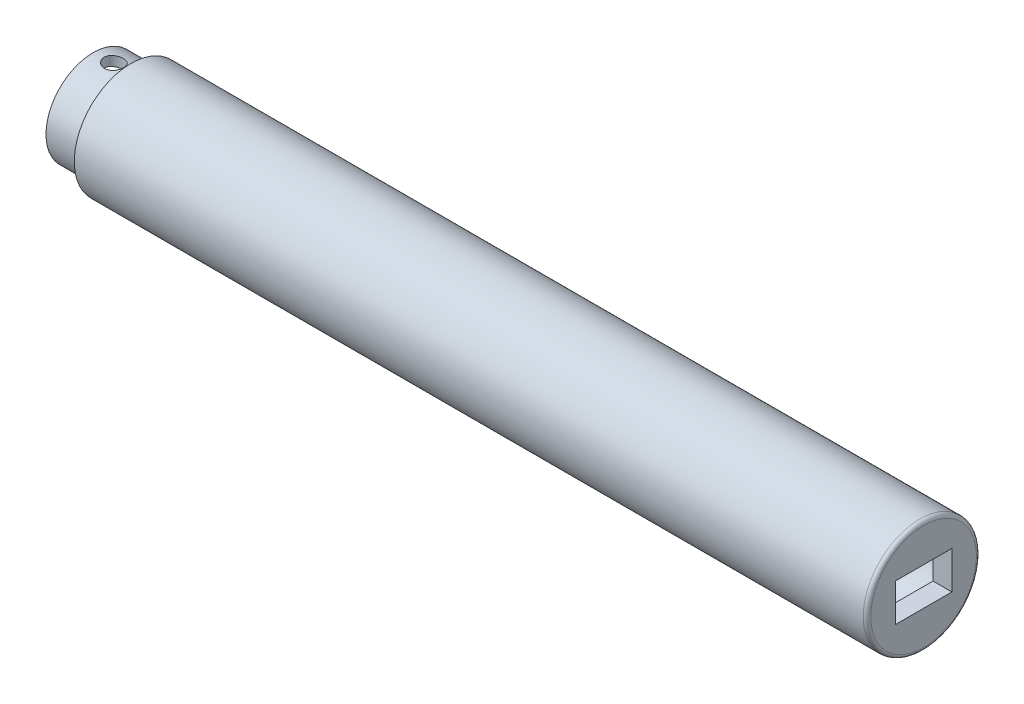
from build123d import *

# Parameters (mm, degrees)
ESBO_O1_R                  = 15
ESBO_O1_R_2                = 12.5
RESSALTO_EXTRUS_O1_DEPTH   = 210
RESSALTO_EXTRUS_O3_START   = 10
ESBO_O2_R                  = 12.5
ESBO_O2_R_2                = 10
RESSALTO_EXTRUS_O3_DEPTH   = 15
CORTE_EXTRUS_O3_DEPTH      = 300
CORTE_EXTRUS_O3_DEPTH_BACK = 300
ESBO_O4_R                  = 2.5
RESSALTO_EXTRUS_O4_START   = -5
ESBO_O9_R                  = 12.5
RESSALTO_EXTRUS_O4_DEPTH   = 5
FILETE1_R                  = 1
ESBO_O11_W                 = 15
ESBO_O11_H                 = 10
CORTE_EXTRUS_O4_DEPTH      = 10


with BuildPart() as part:
    # Esboço1 → Ressalto-extrusão1 (new body)
    with BuildSketch(Plane(origin=(0, 0, 0), x_dir=(0, 0, -1), z_dir=(1, 0, 0))):
        Circle(ESBO_O1_R)
        Circle(ESBO_O1_R_2, mode=Mode.SUBTRACT)
    extrude(amount=RESSALTO_EXTRUS_O1_DEPTH)

    # Esboço2 → Ressalto-extrusão3 (add)
    with BuildSketch(Plane.ZY.offset(RESSALTO_EXTRUS_O3_START)):
        Circle(ESBO_O2_R)
        Circle(ESBO_O2_R_2, mode=Mode.SUBTRACT)
    extrude(amount=-RESSALTO_EXTRUS_O3_DEPTH)

    # Esboço4 → Corte-extrusão3 (cut, two sides: drawn at the far end of the back side and taken through both)
    with BuildSketch(Plane(origin=(0, 0, 0), x_dir=(1, 0, 0), z_dir=(0, 1, 0)).offset(-CORTE_EXTRUS_O3_DEPTH_BACK)):
        with Locations((-5, 0.5)):
            Circle(ESBO_O4_R)
    extrude(amount=CORTE_EXTRUS_O3_DEPTH + CORTE_EXTRUS_O3_DEPTH_BACK, mode=Mode.SUBTRACT)

    # Esboço9 → Ressalto-extrusão4 (add)
    with BuildSketch(Plane(origin=(210, 0, 0), x_dir=(0, 0, -1), z_dir=(1, 0, 0)).offset(RESSALTO_EXTRUS_O4_START)):
        Circle(ESBO_O9_R)
    extrude(amount=RESSALTO_EXTRUS_O4_DEPTH)

    # Filete1
    filete1_edges = [part.edges().sort_by_distance(p)[0] for p in [
        (210, 0, 15),
    ]]
    fillet(filete1_edges, radius=FILETE1_R)

    # Esboço11 → Corte-extrusão4 (cut)
    with BuildSketch(Plane(origin=(210, 0, 0), x_dir=(0, 0, -1), z_dir=(1, 0, 0))):
        Rectangle(ESBO_O11_W, ESBO_O11_H)
    extrude(amount=-CORTE_EXTRUS_O4_DEPTH, mode=Mode.SUBTRACT)


solid = part.part
